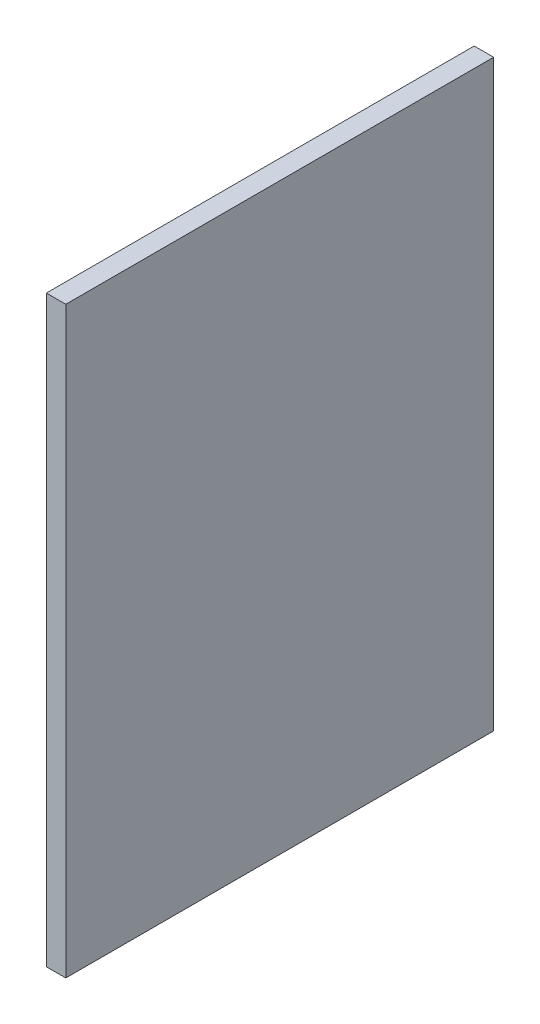
from build123d import *

# Parameters (mm, degrees)
SKIZZE1_W                       = 110
SKIZZE1_H                       = 150
AUFSATZ_LINEAR_AUSTRAGEN1_DEPTH = 5


with BuildPart() as part:
    # Skizze1 → Aufsatz-Linear austragen1 (new body)
    with BuildSketch(Plane(origin=(0, 0, 0), x_dir=(0, 0, -1), z_dir=(1, 0, 0))):
        Rectangle(SKIZZE1_W, SKIZZE1_H)
    extrude(amount=AUFSATZ_LINEAR_AUSTRAGEN1_DEPTH)


solid = part.part
